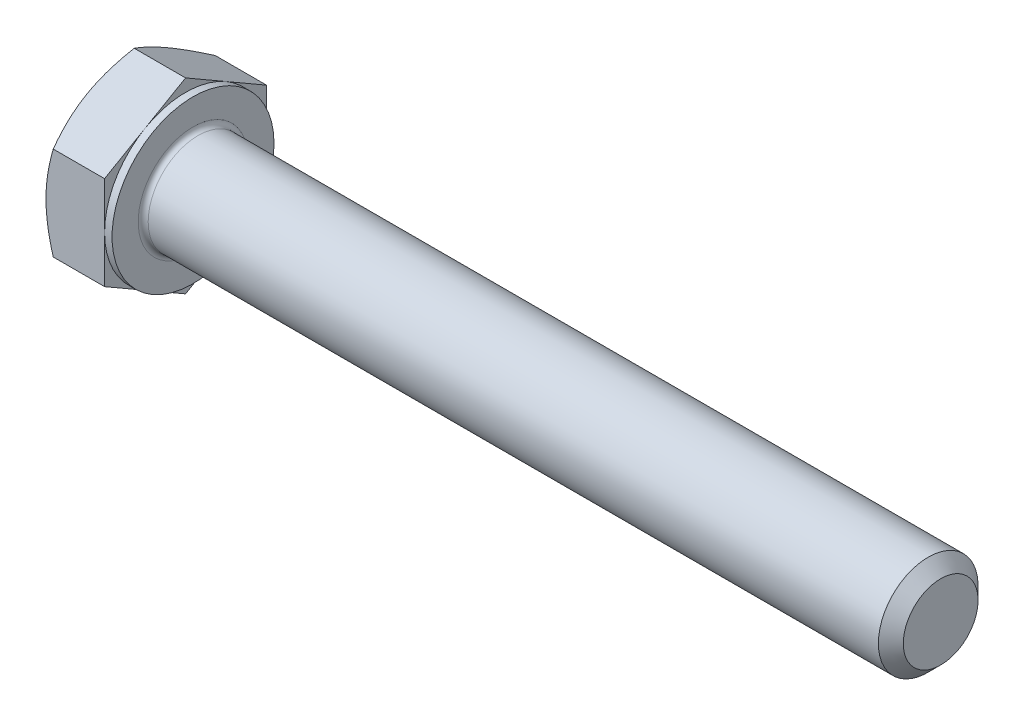
from build123d import *

# Parameters (mm, degrees)
EXTRUDE_370_DEPTH = 5.3
SKETCH_4_W        = 0.6
SKETCH_4_H        = 11.005553499
CHAMFER_2030_SIZE = 1
FILLET_2072_R     = 0.4


with BuildPart() as part:
    # 草图1 → Extrude 370 (new body)
    with BuildSketch(Plane(origin=(0, 0, 0), x_dir=(0, 0, -1), z_dir=(1, 0, 0))):
        Polygon((6.5, 3.75277675), (6.5, -3.75277675), (0, -7.505553499), (-6.5, -3.75277675), (-6.5, 3.75277675), (0, 7.505553499), align=None)
    extrude(amount=EXTRUDE_370_DEPTH)

    # 草图2 → 凸台-旋转1 (revolve)
    with BuildSketch(Plane.XY, mode=Mode.PRIVATE) as revolve_1_sk:
        Polygon((0, 0), (65.3, 0), (65.3, 2.9175), (65.3, 4), (27.8072, 4), (0, 4), align=None)
    revolve(revolve_1_sk.sketch.rotate(Axis((0, 0, 0), (1, 0, 0)), 90), axis=Axis((0, 0, 0), (1, 0, 0)))

    # 草图3 → 切除-旋转1 (revolve, cut)
    with BuildSketch(Plane.XY):
        Polygon((0, 6.5), (3.46730793, 12.505553499), (3.46730793, 17.505553499), (-10, 17.505553499), (-10, 6.5), align=None)
    revolve(axis=Axis((0, 0, 0), (1, 0, 0)), mode=Mode.SUBTRACT)

    # 草图5 → 切除-旋转2 (revolve, cut)
    with BuildSketch(Plane.XY):
        Polygon((5.3, 6.5), (1.83269207, 12.505553499), (1.83269207, 17.505553499), (11.83269207, 17.505553499), (11.83269207, 6.5), align=None)
    revolve(axis=Axis((0, 0, 0), (1, 0, 0)), mode=Mode.SUBTRACT)

    # 草图4 → 切除-旋转3 (revolve, cut)
    with BuildSketch(Plane.XY, mode=Mode.PRIVATE) as cut_revolve_3_sk:
        with Locations((5, 12.00277675)):
            Rectangle(SKETCH_4_W, SKETCH_4_H)
    revolve(cut_revolve_3_sk.sketch.rotate(Axis((0, 0, 0), (1, 0, 0)), 270), axis=Axis((0, 0, 0), (1, 0, 0)), mode=Mode.SUBTRACT)

    # Chamfer 2030
    chamfer_2030_edges = [part.edges().sort_by_distance(p)[0] for p in [
        (65.3, 0, -4),
    ]]
    chamfer(chamfer_2030_edges, length=CHAMFER_2030_SIZE)

    # Fillet 2072
    fillet_2072_edges = [part.edges().sort_by_distance(p)[0] for p in [
        (5.3, 0, -4),
    ]]
    fillet(fillet_2072_edges, radius=FILLET_2072_R)


solid = part.part
